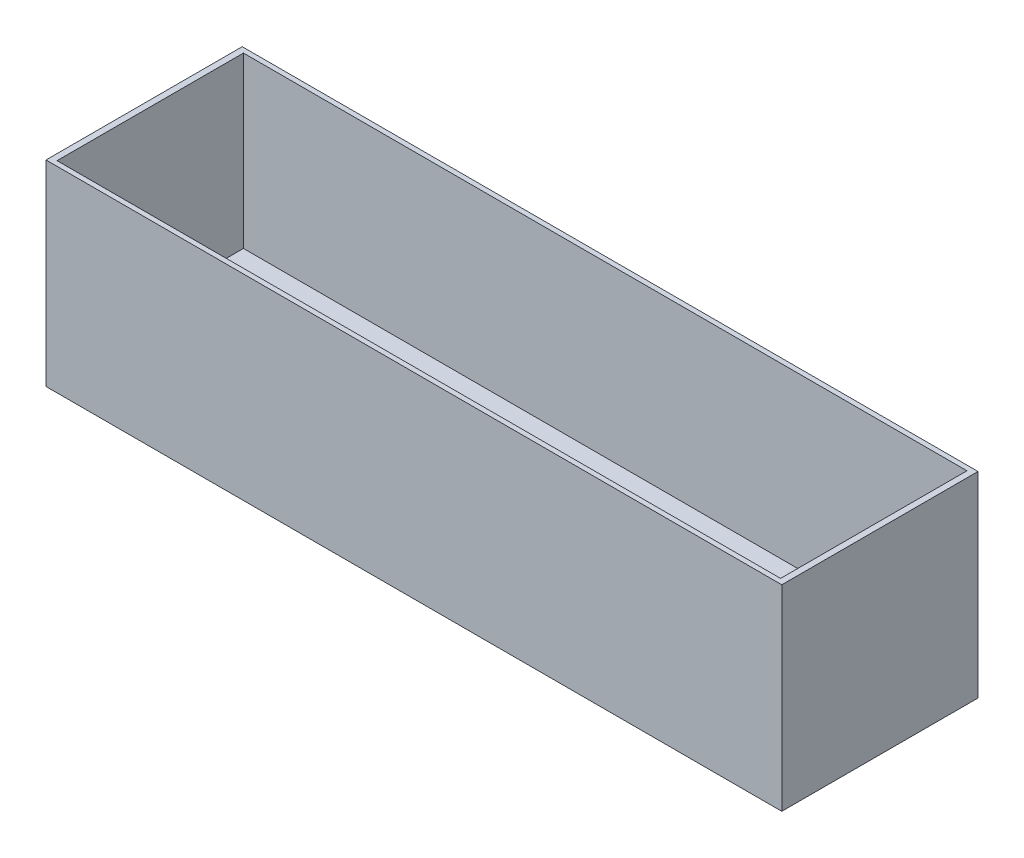
from build123d import *

# Parameters (mm, degrees)
SKETCH1_W           = 3000
SKETCH1_H           = 800
BOSS_EXTRUDE2_DEPTH = 800
SKETCH2_W           = 2950
SKETCH2_H           = 760
CUT_EXTRUDE1_DEPTH  = 690


with BuildPart() as part:
    # Sketch1 → Boss-Extrude2 (new body)
    with BuildSketch(Plane(origin=(0, 0, 0), x_dir=(1, 0, 0), z_dir=(0, 1, 0))):
        Rectangle(SKETCH1_W, SKETCH1_H)
    extrude(amount=BOSS_EXTRUDE2_DEPTH)

    # Sketch2 → Cut-Extrude1 (cut)
    with BuildSketch(Plane(origin=(0, 800, 0), x_dir=(1, 0, 0), z_dir=(0, 1, 0))):
        Rectangle(SKETCH2_W, SKETCH2_H)
    extrude(amount=-CUT_EXTRUDE1_DEPTH, mode=Mode.SUBTRACT)


solid = part.part
